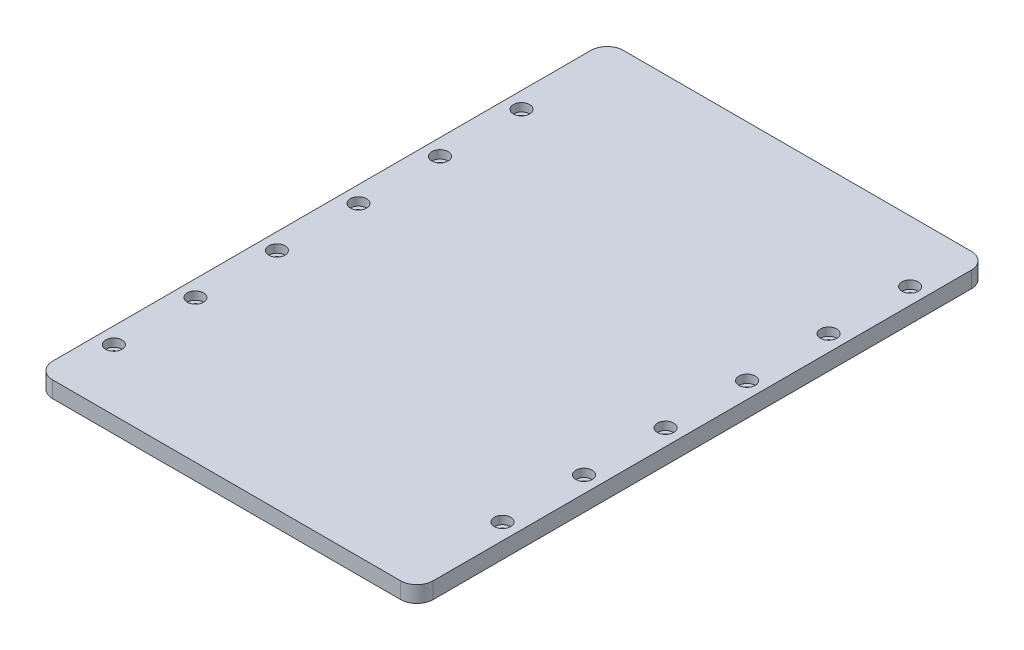
from build123d import *

# Parameters (mm, degrees)
BOSS_EXTRUDE1_DEPTH = 6
SKETCH2_R           = 1.5
CUT_EXTRUDE1_DEPTH  = 10
SKETCH3_R           = 3
SKETCH3_R_2         = 1.5
CUT_EXTRUDE2_DEPTH  = 3


with BuildPart() as part:
    # Sketch1 → Boss-Extrude1 (new body)
    with BuildSketch(Plane(origin=(0, 0, 0), x_dir=(1, 0, 0), z_dir=(0, 1, 0))):
        with BuildLine():
            Line((70, -99), (70, 99))
            ThreePointArc((70, 99), (68.242640687, 103.242640687), (64, 105))
            Line((64, 105), (-64, 105))
            ThreePointArc((-64, 105), (-68.242640687, 103.242640687), (-70, 99))
            Line((-70, 99), (-70, -99))
            ThreePointArc((-70, -99), (-68.242640687, -103.242640687), (-64, -105))
            Line((-64, -105), (64, -105))
            ThreePointArc((64, -105), (68.242640687, -103.242640687), (70, -99))
        make_face()
    extrude(amount=BOSS_EXTRUDE1_DEPTH)

    # Sketch2 → Cut-Extrude1 (cut)
    with BuildSketch(Plane(origin=(0, 6, 0), x_dir=(1, 0, 0), z_dir=(0, 1, 0))):
        with Locations(Location((-64, -82.5, 0), (0, 0, 270))):
            Circle(SKETCH2_R)
        with Locations(Location((-64, -52.5, 0), (0, 0, 270))):
            Circle(SKETCH2_R)
        with Locations(Location((-64, -22.5, 0), (0, 0, 270))):
            Circle(SKETCH2_R)
        with Locations(Location((-64, 7.5, 0), (0, 0, 270))):
            Circle(SKETCH2_R)
        with Locations(Location((-64, 37.5, 0), (0, 0, 270))):
            Circle(SKETCH2_R)
        with Locations(Location((-64, 67.5, 0), (0, 0, 270))):
            Circle(SKETCH2_R)
        with Locations(Location((64, -67.5, 0), (0, 0, 270))):
            Circle(SKETCH2_R)
        with Locations(Location((64, -37.5, 0), (0, 0, 270))):
            Circle(SKETCH2_R)
        with Locations(Location((64, -7.5, 0), (0, 0, 270))):
            Circle(SKETCH2_R)
        with Locations(Location((64, 22.5, 0), (0, 0, 270))):
            Circle(SKETCH2_R)
        with Locations(Location((64, 52.5, 0), (0, 0, 270))):
            Circle(SKETCH2_R)
        with Locations(Location((64, 82.5, 0), (0, 0, 270))):
            Circle(SKETCH2_R)
    extrude(amount=-CUT_EXTRUDE1_DEPTH, mode=Mode.SUBTRACT)

    # Sketch3 → Cut-Extrude2 (cut)
    # profile 1 of 12: a face of its own
    with BuildSketch(Plane(origin=(0, 6, 0), x_dir=(1, 0, 0), z_dir=(0, 1, 0))):
        with Locations(Location((-64, -82.5, 0), (0, 0, 270))):
            Circle(SKETCH3_R)
        with Locations(Location((-64, -82.5, 0), (0, 0, 270))):
            Circle(SKETCH3_R_2, mode=Mode.SUBTRACT)
    # profile 2 of 12: a face of its own
    with BuildSketch(Plane(origin=(0, 6, 0), x_dir=(1, 0, 0), z_dir=(0, 1, 0))):
        with Locations(Location((-64, -52.5, 0), (0, 0, 270))):
            Circle(SKETCH3_R)
    # profile 3 of 12: a face of its own
    with BuildSketch(Plane(origin=(0, 6, 0), x_dir=(1, 0, 0), z_dir=(0, 1, 0))):
        with Locations(Location((-64, -22.5, 0), (0, 0, 270))):
            Circle(SKETCH3_R)
    # profile 4 of 12: a face of its own
    with BuildSketch(Plane(origin=(0, 6, 0), x_dir=(1, 0, 0), z_dir=(0, 1, 0))):
        with Locations(Location((-64, 7.5, 0), (0, 0, 270))):
            Circle(SKETCH3_R)
    # profile 5 of 12: a face of its own
    with BuildSketch(Plane(origin=(0, 6, 0), x_dir=(1, 0, 0), z_dir=(0, 1, 0))):
        with Locations(Location((-64, 37.5, 0), (0, 0, 270))):
            Circle(SKETCH3_R)
    # profile 6 of 12: a face of its own
    with BuildSketch(Plane(origin=(0, 6, 0), x_dir=(1, 0, 0), z_dir=(0, 1, 0))):
        with Locations(Location((-64, 67.5, 0), (0, 0, 270))):
            Circle(SKETCH3_R)
    # profile 7 of 12: a face of its own
    with BuildSketch(Plane(origin=(0, 6, 0), x_dir=(1, 0, 0), z_dir=(0, 1, 0))):
        with Locations(Location((64, -67.5, 0), (0, 0, 270))):
            Circle(SKETCH3_R)
        with Locations(Location((64, -67.5, 0), (0, 0, 270))):
            Circle(SKETCH3_R_2, mode=Mode.SUBTRACT)
    # profile 8 of 12: a face of its own
    with BuildSketch(Plane(origin=(0, 6, 0), x_dir=(1, 0, 0), z_dir=(0, 1, 0))):
        with Locations(Location((64, -37.5, 0), (0, 0, 270))):
            Circle(SKETCH3_R)
        with Locations(Location((64, -37.5, 0), (0, 0, 270))):
            Circle(SKETCH3_R_2, mode=Mode.SUBTRACT)
    # profile 9 of 12: a face of its own
    with BuildSketch(Plane(origin=(0, 6, 0), x_dir=(1, 0, 0), z_dir=(0, 1, 0))):
        with Locations(Location((64, -7.5, 0), (0, 0, 270))):
            Circle(SKETCH3_R)
        with Locations(Location((64, -7.5, 0), (0, 0, 270))):
            Circle(SKETCH3_R_2, mode=Mode.SUBTRACT)
    # profile 10 of 12: a face of its own
    with BuildSketch(Plane(origin=(0, 6, 0), x_dir=(1, 0, 0), z_dir=(0, 1, 0))):
        with Locations(Location((64, 22.5, 0), (0, 0, 270))):
            Circle(SKETCH3_R)
        with Locations(Location((64, 22.5, 0), (0, 0, 270))):
            Circle(SKETCH3_R_2, mode=Mode.SUBTRACT)
    # profile 11 of 12: a face of its own
    with BuildSketch(Plane(origin=(0, 6, 0), x_dir=(1, 0, 0), z_dir=(0, 1, 0))):
        with Locations(Location((64, 52.5, 0), (0, 0, 270))):
            Circle(SKETCH3_R)
        with Locations(Location((64, 52.5, 0), (0, 0, 270))):
            Circle(SKETCH3_R_2, mode=Mode.SUBTRACT)
    # profile 12 of 12: a face of its own
    with BuildSketch(Plane(origin=(0, 6, 0), x_dir=(1, 0, 0), z_dir=(0, 1, 0))):
        with Locations(Location((64, 82.5, 0), (0, 0, 270))):
            Circle(SKETCH3_R)
        with Locations(Location((64, 82.5, 0), (0, 0, 270))):
            Circle(SKETCH3_R_2, mode=Mode.SUBTRACT)
    extrude(amount=-CUT_EXTRUDE2_DEPTH, mode=Mode.SUBTRACT)


solid = part.part
